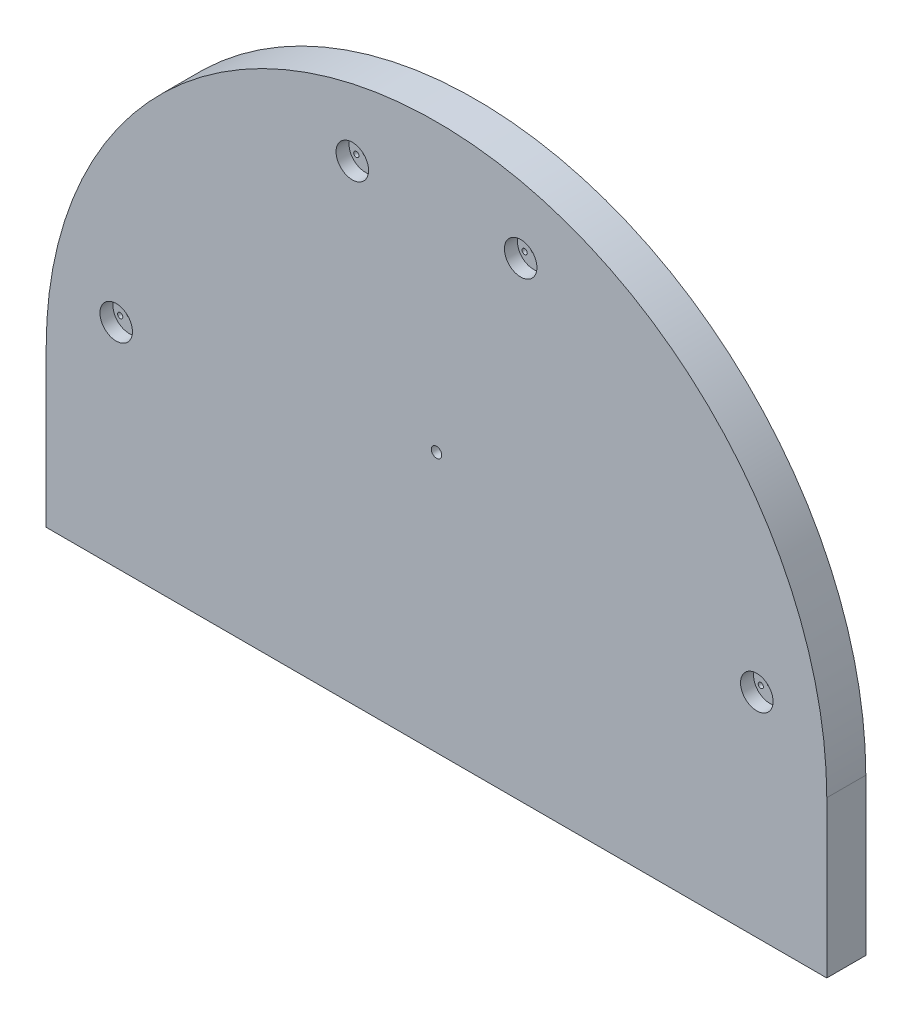
from build123d import *

# Parameters (mm, degrees)
EXTRUDE_1_DEPTH     = 30
SKETCH_2_R          = 12.5
CUT_EXTRUDE_1_DEPTH = 10
SKETCH_4_R          = 2
CUT_EXTRUDE_2_DEPTH = 20
SKETCH_6_R          = 4
CUT_EXTRUDE_3_DEPTH = 59


with BuildPart() as part:
    # 草图1 → 凸台-拉伸1 (new body)
    with BuildSketch(Plane.XY):
        with BuildLine():
            Line((-300, 0), (-300, -120))
            Line((-300, -120), (300, -120))
            Line((300, -120), (300, 0))
            ThreePointArc((300, 0), (0, 300), (-300, 0))
        make_face()
    extrude(amount=EXTRUDE_1_DEPTH)

    # 草图2 → 切除-拉伸1 (cut)
    with BuildSketch(Plane.XY.offset(30)):
        with Locations((-246.201938253, 43.412044417)):
            Circle(SKETCH_2_R)
        with Locations((-64.704761276, 241.481456572)):
            Circle(SKETCH_2_R)
        with Locations(Location((246.201938253, 43.412044417, 0), (0, 0, 180))):
            Circle(SKETCH_2_R)
        with Locations(Location((64.704761276, 241.481456572, 0), (0, 0, 180))):
            Circle(SKETCH_2_R)
    extrude(amount=-CUT_EXTRUDE_1_DEPTH, mode=Mode.SUBTRACT)

    # 草图4 → 切除-拉伸2 (cut)
    with BuildSketch(Plane.XY.offset(20)):
        with Locations((-246.201938253, 43.412044417)):
            Circle(SKETCH_4_R)
        with Locations((-246.201938253, 51.412044417)):
            Circle(SKETCH_4_R)
        with Locations((-253.130141483, 39.412044417)):
            Circle(SKETCH_4_R)
        with Locations((-239.273735023, 39.412044417)):
            Circle(SKETCH_4_R)
        with Locations((-64.704761276, 249.481456572)):
            Circle(SKETCH_4_R)
        with Locations((-71.632964506, 237.481456572)):
            Circle(SKETCH_4_R)
        with Locations((-57.776558045, 237.481456572)):
            Circle(SKETCH_4_R)
        with Locations((-64.704761276, 241.481456572)):
            Circle(SKETCH_4_R)
        with Locations(Location((64.704761276, 241.481456572, 0), (0, 0, 180))):
            Circle(SKETCH_4_R)
        with Locations(Location((57.776558045, 237.481456572, 0), (0, 0, 180))):
            Circle(SKETCH_4_R)
        with Locations(Location((71.632964506, 237.481456572, 0), (0, 0, 180))):
            Circle(SKETCH_4_R)
        with Locations(Location((64.704761276, 249.481456572, 0), (0, 0, 180))):
            Circle(SKETCH_4_R)
        with Locations(Location((239.273735023, 39.412044417, 0), (0, 0, 180))):
            Circle(SKETCH_4_R)
        with Locations(Location((253.130141483, 39.412044417, 0), (0, 0, 180))):
            Circle(SKETCH_4_R)
        with Locations(Location((246.201938253, 51.412044417, 0), (0, 0, 180))):
            Circle(SKETCH_4_R)
        with Locations(Location((246.201938253, 43.412044417, 0), (0, 0, 180))):
            Circle(SKETCH_4_R)
    extrude(amount=-CUT_EXTRUDE_2_DEPTH, mode=Mode.SUBTRACT)

    # 草图6 → 切除-拉伸3 (cut)
    with BuildSketch(Plane(origin=(0, 0, 0), x_dir=(-1, 0, 0), z_dir=(0, 0, -1))):
        with Locations((0, 80)):
            Circle(SKETCH_6_R)
    extrude(amount=-CUT_EXTRUDE_3_DEPTH, mode=Mode.SUBTRACT)


solid = part.part
